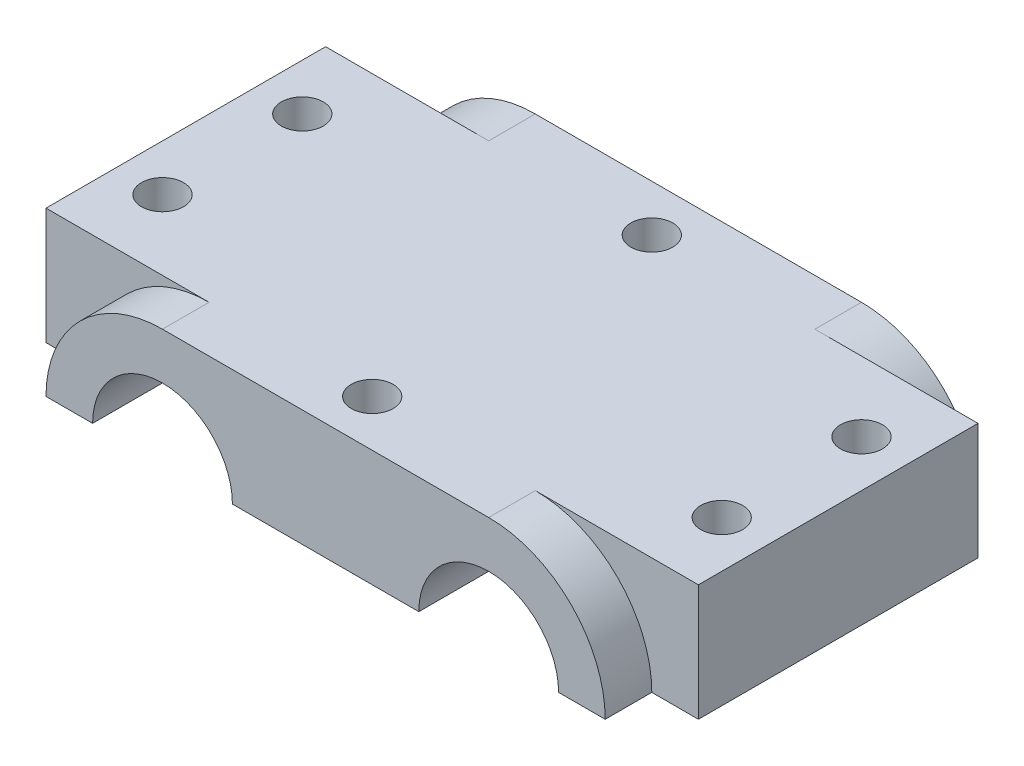
from build123d import *

# Parameters (mm, degrees)
BOSS_EXTRUDE3_DEPTH     = 15
SKETCH2_R               = 2.25
CUT_EXTRUDE3_DEPTH      = 73.672209269
BOSS_EXTRUDE4_DEPTH     = 20
CUT_EXTRUDE4_DEPTH      = 74.866433513
CUT_EXTRUDE4_DEPTH_BACK = 74.866433513
SKETCH4_R               = 2.25


with BuildPart() as part:
    # Sketch1 → Boss-Extrude3 (new, symmetric)
    with BuildSketch(Plane.XY):
        with BuildLine():
            Line((0, 12.5), (0, 0))
            Line((0, 0), (10, 0))
            ThreePointArc((10, 0), (17.5, 7.5), (25, 0))
            Line((25, 0), (45, 0))
            ThreePointArc((45, 0), (52.5, 7.5), (60, 0))
            Line((60, 0), (70, 0))
            Line((70, 0), (70, 12.5))
            Line((70, 12.5), (0, 12.5))
        make_face()
    extrude(amount=BOSS_EXTRUDE3_DEPTH, both=True)

    # Sketch2 → Cut-Extrude3 (cut, through all)
    with BuildSketch(Plane(origin=(0, 12.5, 0), x_dir=(1, 0, 0), z_dir=(0, 1, 0))):
        with Locations((35, -5)):
            Circle(SKETCH2_R)
        with Locations((35, -35)):
            Circle(SKETCH2_R)
    extrude(amount=-CUT_EXTRUDE3_DEPTH, mode=Mode.SUBTRACT)

    # Sketch1<9> → Boss-Extrude4 (add, symmetric)
    with BuildSketch(Plane.XY):
        with BuildLine():
            ThreePointArc((17.5, 12.5), (8.661165235, 8.838834765), (5, 0))
            Line((5, 0), (10, 0))
            ThreePointArc((10, 0), (17.5, 7.5), (25, 0))
            Line((25, 0), (45, 0))
            ThreePointArc((45, 0), (52.5, 7.5), (60, 0))
            Line((60, 0), (65, 0))
            ThreePointArc((65, 0), (61.338834765, 8.838834765), (52.5, 12.5))
            Line((52.5, 12.5), (17.5, 12.5))
        make_face()
    extrude(amount=BOSS_EXTRUDE4_DEPTH, both=True)

    # Sketch4 → Cut-Extrude4 (cut, two sides: drawn at the far end of the back side and taken through both)
    with BuildSketch(Plane(origin=(0, 12.5, 0), x_dir=(1, 0, 0), z_dir=(0, 1, 0)).offset(-CUT_EXTRUDE4_DEPTH_BACK)):
        with Locations((35, 15)):
            Circle(SKETCH4_R)
        with Locations((5, 7.5)):
            Circle(SKETCH4_R)
        with Locations((65, 7.5)):
            Circle(SKETCH4_R)
        with Locations((35, -15)):
            Circle(SKETCH4_R)
        with Locations((65, -7.5)):
            Circle(SKETCH4_R)
        with Locations((5, -7.5)):
            Circle(SKETCH4_R)
    extrude(amount=CUT_EXTRUDE4_DEPTH + CUT_EXTRUDE4_DEPTH_BACK, mode=Mode.SUBTRACT)


solid = part.part
